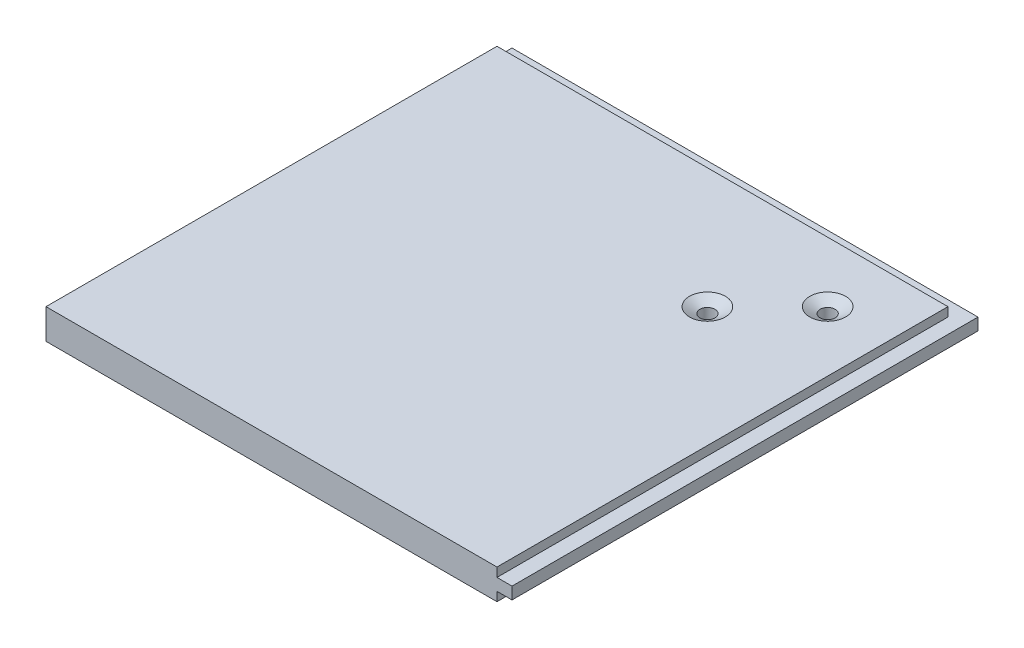
from build123d import *
from OCP.BRepFilletAPI import BRepFilletAPI_MakeChamfer

# Parameters (mm, degrees)
SKETCH1_W               = 150
SKETCH1_H               = 150
BOSS_EXTRUDE1_DEPTH     = 10
SKETCH2_W               = 150
SKETCH2_H               = 4
BOSS_EXTRUDE2_DEPTH     = 5
SKETCH3_W               = 155
SKETCH3_H               = 4
BOSS_EXTRUDE3_DEPTH     = 5
CUT_EXTRUDE1_DEPTH      = 220.431082575
CUT_EXTRUDE1_DEPTH_BACK = 220.431082575
SKETCH4_R               = 2.5
CHAMFER1_SIZE           = 2
CHAMFER1_SIZE2          = 3.464101615


with BuildPart() as part:
    # Sketch1 → Boss-Extrude1 (new body)
    with BuildSketch(Plane(origin=(0, 0, 0), x_dir=(1, 0, 0), z_dir=(0, 1, 0))):
        with Locations((75, 75)):
            Rectangle(SKETCH1_W, SKETCH1_H)
    extrude(amount=BOSS_EXTRUDE1_DEPTH)

    # Sketch2 → Boss-Extrude2 (add)
    with BuildSketch(Plane(origin=(150, 0, 0), x_dir=(0, 0, -1), z_dir=(1, 0, 0))):
        with Locations((75, 5)):
            Rectangle(SKETCH2_W, SKETCH2_H)
    extrude(amount=BOSS_EXTRUDE2_DEPTH)

    # Sketch3 → Boss-Extrude3 (add)
    with BuildSketch(Plane(origin=(0, 0, -150), x_dir=(-1, 0, 0), z_dir=(0, 0, -1))):
        with Locations((-77.5, 5)):
            Rectangle(SKETCH3_W, SKETCH3_H)
    extrude(amount=BOSS_EXTRUDE3_DEPTH)

    # Sketch4 → Cut-Extrude1 (cut, two sides: drawn at the far end of the back side and taken through both)
    with BuildSketch(Plane(origin=(0, 10, 0), x_dir=(1, 0, 0), z_dir=(0, 1, 0)).offset(-CUT_EXTRUDE1_DEPTH_BACK)):
        with Locations(Location((130, 130, 0), (0, 0, 270))):
            Circle(SKETCH4_R)
        with Locations(Location((110, 110, 0), (0, 0, 270))):
            Circle(SKETCH4_R)
    extrude(amount=CUT_EXTRUDE1_DEPTH + CUT_EXTRUDE1_DEPTH_BACK, mode=Mode.SUBTRACT)

    # Chamfer1: one chamfer whose edges measure the first distance from different faces: ONE call of the kernel's chamfer builder (chamfer() names one face for all edges)
    chamfer1_edges_1 = [part.edges().sort_by_distance(p)[0] for p in [
        (130, 10, -132.5),
    ]]
    chamfer1_side_1 = [part.faces().sort_by_distance(p)[0] for p in [
        (130, 5, -132.5),
    ]]
    chamfer1_edges_2 = [part.edges().sort_by_distance(p)[0] for p in [
        (110, 10, -112.5),
    ]]
    chamfer1_side_2 = [part.faces().sort_by_distance(p)[0] for p in [
        (110, 5, -112.5),
    ]]
    chamfer1 = BRepFilletAPI_MakeChamfer(part.part.solid().wrapped)
    for e in chamfer1_edges_1:
        chamfer1.Add(CHAMFER1_SIZE, CHAMFER1_SIZE2, e.wrapped, chamfer1_side_1[0].wrapped)  # the first distance lies on this face
    for e in chamfer1_edges_2:
        chamfer1.Add(CHAMFER1_SIZE, CHAMFER1_SIZE2, e.wrapped, chamfer1_side_2[0].wrapped)  # the first distance lies on this face
    add(Compound.cast(chamfer1.Shape()), mode=Mode.REPLACE)


solid = part.part
